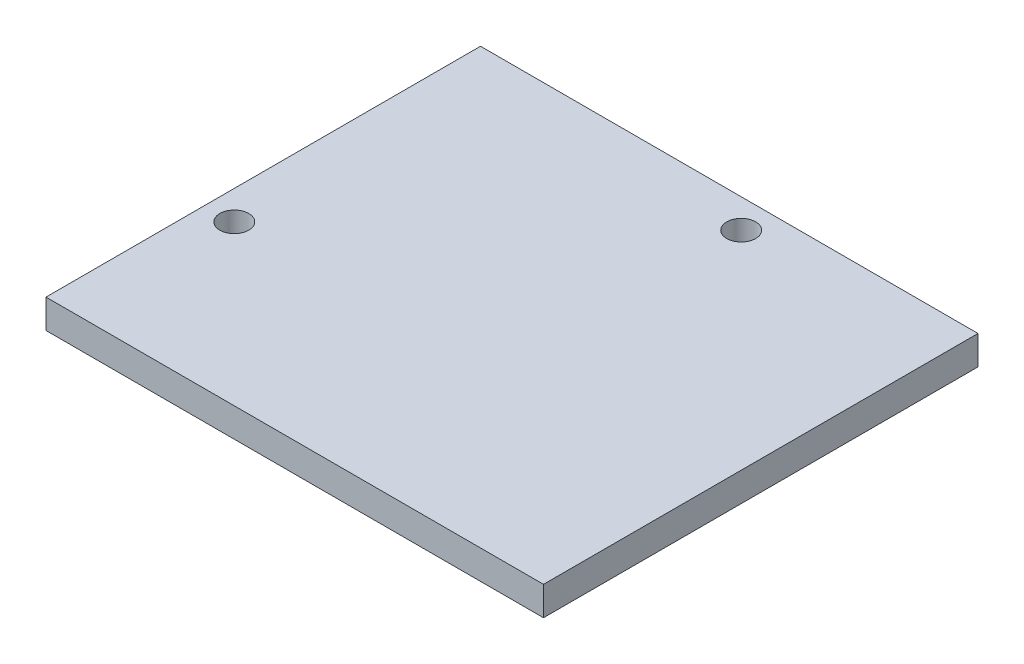
from build123d import *

# Parameters (mm, degrees)
SKETCH1_W           = 43.6245
SKETCH1_H           = 38.1
SKETCH1_R           = 1.27
BOSS_EXTRUDE1_DEPTH = 2.54


with BuildPart() as part:
    # Sketch1 → Boss-Extrude1 (new body)
    with BuildSketch(Plane(origin=(0, 0, 0), x_dir=(1, 0, 0), z_dir=(0, 1, 0))):
        with Locations((21.81225, -19.05)):
            Rectangle(SKETCH1_W, SKETCH1_H)
        with Locations(Location((25.4, -2.54, 0), (0, 0, 270))):
            Circle(SKETCH1_R, mode=Mode.SUBTRACT)
        with Locations(Location((2.54, -24.13, 0), (0, 0, 270))):
            Circle(SKETCH1_R, mode=Mode.SUBTRACT)
    extrude(amount=BOSS_EXTRUDE1_DEPTH)


solid = part.part
